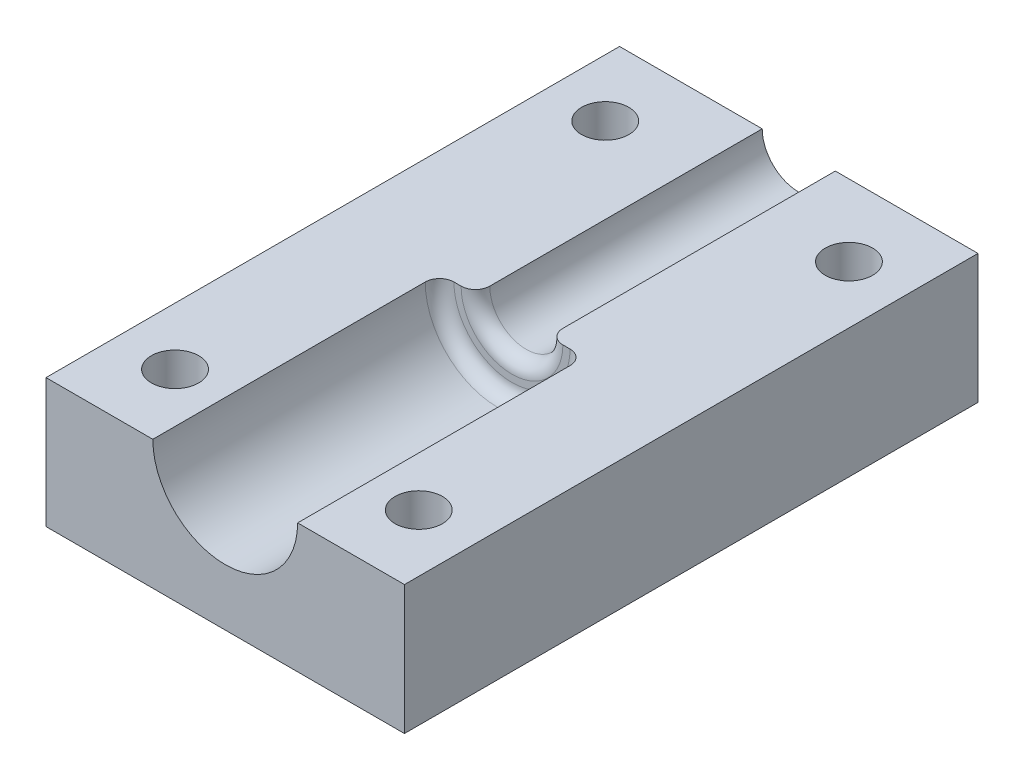
from build123d import *

# Parameters (mm, degrees)
SKIZZE1_W                       = 25
SKIZZE1_H                       = 40
SKIZZE1_R                       = 1.65
AUFSATZ_LINEAR_AUSTRAGEN1_DEPTH = 9
SCHNITT_LINEAR_AUSTRAGEN2_DEPTH = 20
SCHNITT_LINEAR_AUSTRAGEN3_DEPTH = 20
VERRUNDUNG1_R                   = 1


with BuildPart() as part:
    # Skizze1 → Aufsatz-Linear austragen1 (new body)
    with BuildSketch(Plane(origin=(0, 0, 0), x_dir=(1, 0, 0), z_dir=(0, 1, 0))):
        with Locations((12.5, 20)):
            Rectangle(SKIZZE1_W, SKIZZE1_H)
        with Locations(Location((4, 5, 0), (0, 0, 270))):
            Circle(SKIZZE1_R, mode=Mode.SUBTRACT)
        with Locations(Location((21, 5, 0), (0, 0, 270))):
            Circle(SKIZZE1_R, mode=Mode.SUBTRACT)
        with Locations(Location((21, 35, 0), (0, 0, 270))):
            Circle(SKIZZE1_R, mode=Mode.SUBTRACT)
        with Locations(Location((4, 35, 0), (0, 0, 270))):
            Circle(SKIZZE1_R, mode=Mode.SUBTRACT)
    extrude(amount=AUFSATZ_LINEAR_AUSTRAGEN1_DEPTH)

    # Skizze3 → Schnitt-Linear austragen2 (cut)
    with BuildSketch(Plane(origin=(0, 0, -40), x_dir=(-1, 0, 0), z_dir=(0, 0, -1))):
        with BuildLine():
            Line((-15.05, 9), (-9.95, 9))
            ThreePointArc((-9.95, 9), (-12.5, 6.45), (-15.05, 9))
        make_face()
    extrude(amount=-SCHNITT_LINEAR_AUSTRAGEN2_DEPTH, mode=Mode.SUBTRACT)

    # Skizze2 → Schnitt-Linear austragen3 (cut)
    with BuildSketch(Plane.XY):
        with BuildLine():
            Line((17.55, 9), (7.45, 9))
            ThreePointArc((7.45, 9), (12.5, 3.95), (17.55, 9))
        make_face()
    extrude(amount=-SCHNITT_LINEAR_AUSTRAGEN3_DEPTH, mode=Mode.SUBTRACT)

    # Verrundung1
    verrundung1_edges = [part.edges().sort_by_distance(p)[0] for p in [
        (12.5, 6.45, -20),
        (12.5, 3.95, -20),
    ]]
    fillet(verrundung1_edges, radius=VERRUNDUNG1_R)


solid = part.part
